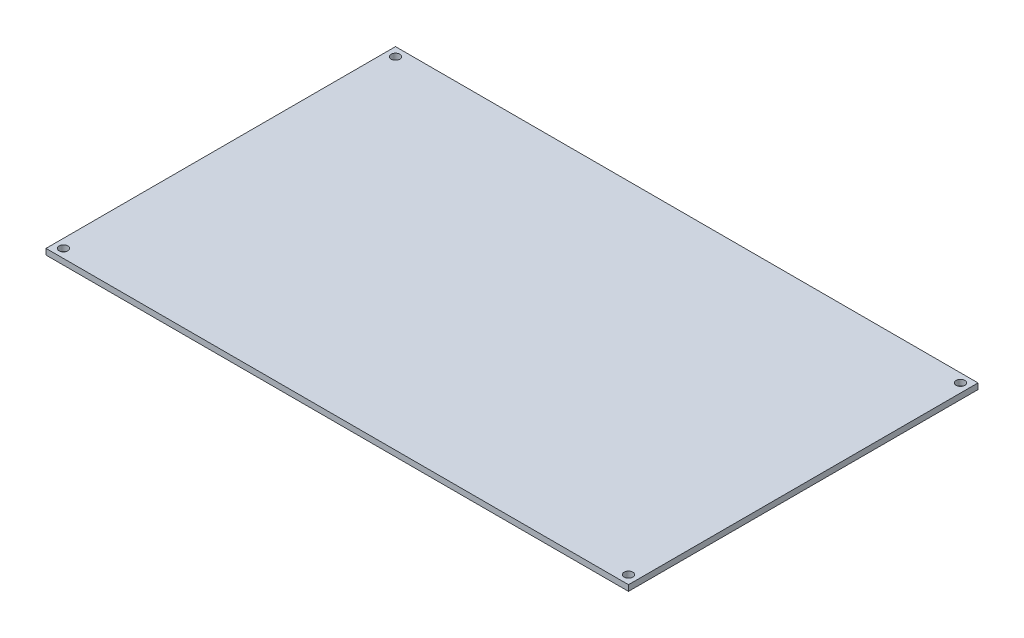
from build123d import *

# Parameters (mm, degrees)
SKETCH1_W           = 200
SKETCH1_H           = 120
BOSS_EXTRUDE1_DEPTH = 2
SKETCH2_R           = 1.5
CUT_EXTRUDE1_DEPTH  = 3


with BuildPart() as part:
    # Sketch1 → Boss-Extrude1 (new body)
    with BuildSketch(Plane(origin=(0, 0, 0), x_dir=(1, 0, 0), z_dir=(0, 1, 0))):
        with Locations((100, 60)):
            Rectangle(SKETCH1_W, SKETCH1_H)
    extrude(amount=BOSS_EXTRUDE1_DEPTH)

    # Sketch2 → Cut-Extrude1 (cut)
    with BuildSketch(Plane(origin=(0, 2, 0), x_dir=(1, 0, 0), z_dir=(0, 1, 0))):
        with Locations(Location((197, 117, 0), (0, 0, 270))):
            Circle(SKETCH2_R)
        with Locations(Location((197, 3, 0), (0, 0, 270))):
            Circle(SKETCH2_R)
        with Locations(Location((3, 3, 0), (0, 0, 270))):
            Circle(SKETCH2_R)
        with Locations(Location((3, 117, 0), (0, 0, 270))):
            Circle(SKETCH2_R)
    extrude(amount=-CUT_EXTRUDE1_DEPTH, mode=Mode.SUBTRACT)


solid = part.part
